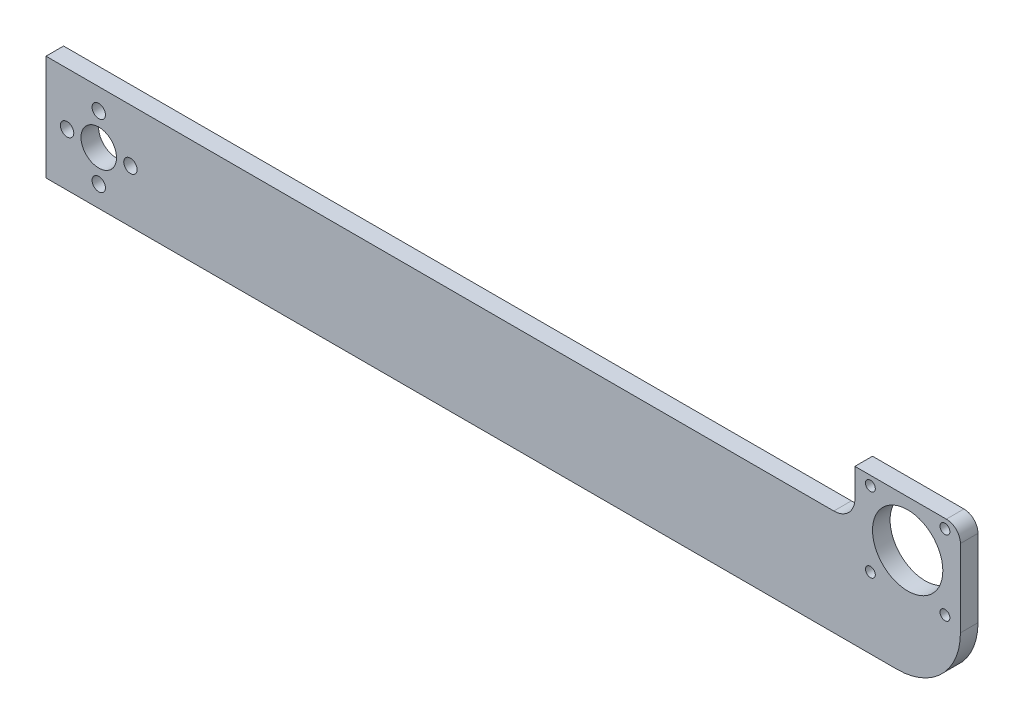
from build123d import *

# Parameters (mm, degrees)
SKETCH1_R           = 6.4135
SKETCH1_R_2         = 2.413
SKETCH1_R_3         = 12.7
SKETCH1_R_4         = 1.778
BOSS_EXTRUDE1_DEPTH = 6.35
FILLET1_R           = 5.08


with BuildPart() as part:
    # Sketch1 → Boss-Extrude1 (new body)
    with BuildSketch(Plane.XY):
        with BuildLine():
            Line((-19.05, 19.05), (265.43, 19.05))
            ThreePointArc((265.43, 19.05), (270.818153673, 21.281846327), (273.05, 26.67))
            Line((273.05, 26.67), (273.05, 36.83))
            Line((273.05, 36.83), (311.15, 36.83))
            Line((311.15, 36.83), (311.15, 3.81))
            ThreePointArc((311.15, 3.81), (304.454461018, -12.354461018), (288.29, -19.05))
            Line((288.29, -19.05), (286.189260549, -19.05))
            Line((286.189260549, -19.05), (-19.05, -19.05))
            Line((-19.05, -19.05), (-19.05, 19.05))
        make_face()
        Circle(SKETCH1_R, mode=Mode.SUBTRACT)
        with Locations((0, 11.43)):
            Circle(SKETCH1_R_2, mode=Mode.SUBTRACT)
        with Locations((11.43, 0)):
            Circle(SKETCH1_R_2, mode=Mode.SUBTRACT)
        with Locations((0, -11.43)):
            Circle(SKETCH1_R_2, mode=Mode.SUBTRACT)
        with Locations((-11.43, 0)):
            Circle(SKETCH1_R_2, mode=Mode.SUBTRACT)
        with Locations((292.1, 20.066)):
            Circle(SKETCH1_R_3, mode=Mode.SUBTRACT)
        with Locations((278.638, 33.544763148)):
            Circle(SKETCH1_R_4, mode=Mode.SUBTRACT)
        with Locations((305.562, 33.544763148)):
            Circle(SKETCH1_R_4, mode=Mode.SUBTRACT)
        with Locations((305.562, 6.587236852)):
            Circle(SKETCH1_R_4, mode=Mode.SUBTRACT)
        with Locations((278.638, 6.587236852)):
            Circle(SKETCH1_R_4, mode=Mode.SUBTRACT)
    extrude(amount=BOSS_EXTRUDE1_DEPTH)

    # Fillet1
    fillet1_edges = [part.edges().sort_by_distance(p)[0] for p in [
        (311.15, 36.83, 3.175),
    ]]
    fillet(fillet1_edges, radius=FILLET1_R)


solid = part.part
